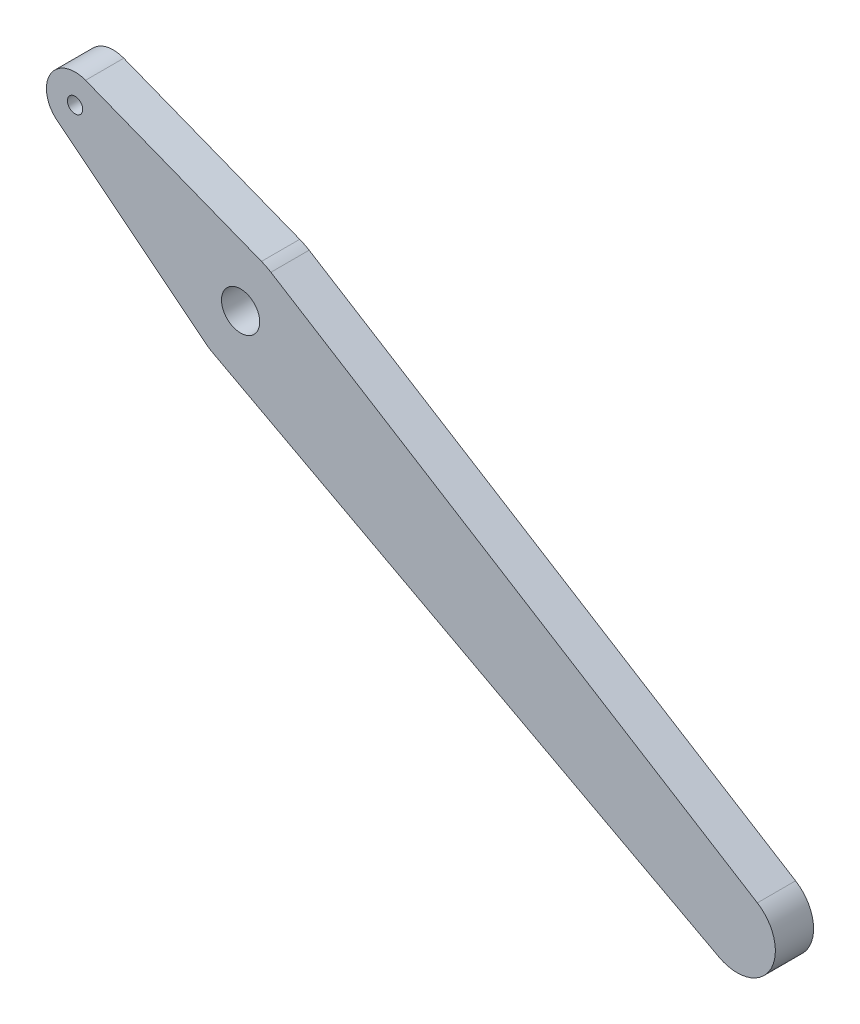
from build123d import *

# Parameters (mm, degrees)
BOSS_EXTRUDE1_DEPTH     = 5
CUT_EXTRUDE1_DEPTH      = 164.77752047
CUT_EXTRUDE1_DEPTH_BACK = 164.77752047
SKETCH2_R               = 2
SKETCH2_R_2             = 5


with BuildPart() as part:
    # Sketch1 → Boss-Extrude1 (new, symmetric)
    with BuildSketch(Plane.XY):
        with BuildLine():
            Line((5.466587816, 13.968407842), (-40.567976281, 31.984203921))
            ThreePointArc((-40.567976281, 31.984203921), (-49.796460718, 28.75), (-47.983121256, 19.140796079))
            Line((-47.983121256, 19.140796079), (-9.363702133, -11.718407842))
            ThreePointArc((-9.363702133, -11.718407842), (-8.248107249, -12.528716088), (-7.062819473, -13.233162173))
            Line((-7.062819473, -13.233162173), (125.195264252, -83.822108115))
            ThreePointArc((125.195264252, -83.822108115), (138.564064606, -80), (135.189707152, -66.511225218))
            Line((135.189707152, -66.511225218), (7.928844877, 12.733162173))
            ThreePointArc((7.928844877, 12.733162173), (6.726132784, 13.407428455), (5.466587816, 13.968407842))
        make_face()
    extrude(amount=BOSS_EXTRUDE1_DEPTH, both=True)

    # Sketch2 → Cut-Extrude1 (cut, two sides: drawn at the far end of the back side and taken through both)
    with BuildSketch(Plane.XY.offset(-CUT_EXTRUDE1_DEPTH_BACK)):
        with Locations((-43.301270189, 25)):
            Circle(SKETCH2_R)
        Circle(SKETCH2_R_2)
    extrude(amount=CUT_EXTRUDE1_DEPTH + CUT_EXTRUDE1_DEPTH_BACK, mode=Mode.SUBTRACT)


solid = part.part
